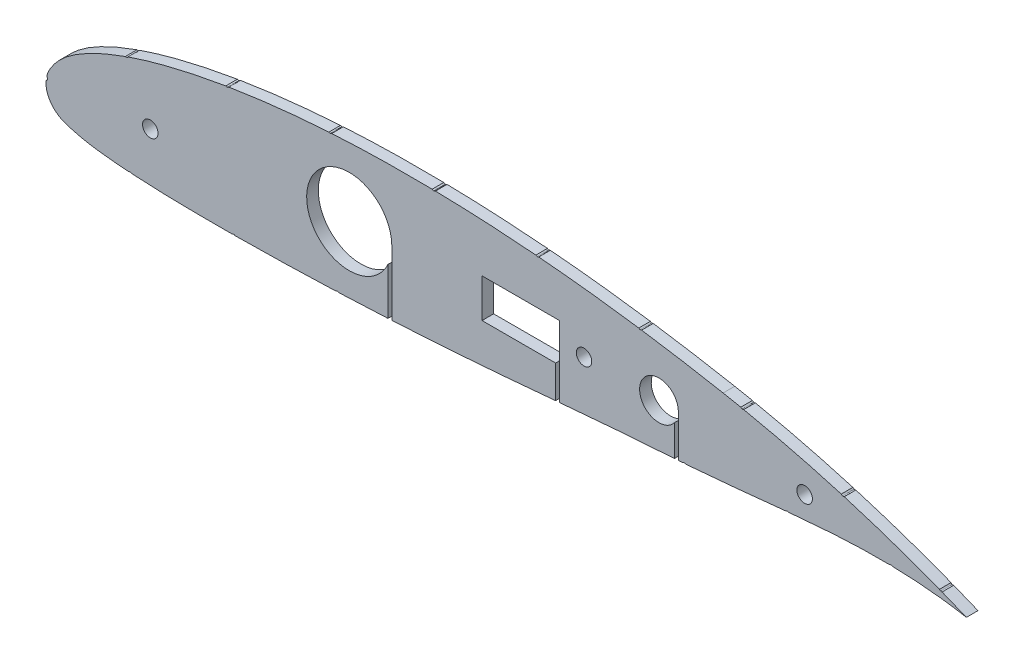
from build123d import *

# Parameters (mm, degrees)
SKETCH5_R           = 2
BOSS_EXTRUDE1_DEPTH = 3
CUT_EXTRUDE1_DEPTH  = 10


with BuildPart() as part:
    # Sketch5 → Boss-Extrude1 (new body)
    with BuildSketch(Plane.XY):
        with BuildLine():
            ThreePointArc((-60.40676614, 16.162496642), (-81.15385877, 23.090280217), (-59.40676614, 20.745072337))
            Line((-59.40676614, 20.745072337), (-59.40676614, 4.127531865))
            add(Edge.make_bspline(
                [(-59.40676614, 4.127531865), (-56.018262466, 4.308098308), (-47.937394752, 4.779305212), (-35.160445535, 5.701220122), (-24.536889777, 6.648809407), (-18.536419357, 7.188062), (-17.192502191, 7.308335338), (-17.109161558, 7.315791129)],
                knots=[1.696187526, 1.696187526, 1.696187526, 1.696187526, 1.71875, 1.75, 1.78125, 1.789719737, 1.790279718, 1.790279718, 1.790279718, 1.790279718], degree=3))
            Line((-17.109161558, 7.315791129), (-17.109161558, 15.745072337))
            Line((-17.109161558, 15.745072337), (-36.109161558, 15.745072337))
            Line((-36.109161558, 15.745072337), (-36.109161558, 25.745072337))
            Line((-36.109161558, 25.745072337), (-16.109161558, 25.745072337))
            Line((-16.109161558, 25.745072337), (-16.109161558, 7.405095685))
            add(Edge.make_bspline(
                [(-16.109161558, 7.405095685), (-16.025835477, 7.412523422), (-13.052799236, 7.677419778), (-5.437797345, 8.345259497), (3.85457575, 9.082728966), (10.779350171, 9.549869356), (13.069020219, 9.692680395), (13.59323386, 9.72473994)],
                knots=[0.792519643, 0.792519643, 0.792519643, 0.792519643, 0.793079624, 0.8125, 0.84375, 0.855658983, 0.859195484, 0.859195484, 0.859195484, 0.859195484], degree=3))
            Line((13.59323386, 9.72473994), (13.59323386, 17.745072337))
            ThreePointArc((13.59323386, 17.745072337), (4.84981737, 22.326211167), (14.59323386, 20.745072337))
            Line((14.59323386, 20.745072337), (14.59323386, 9.787860429))
            add(Edge.make_bspline(
                [(14.59323386, 9.787860429), (39.457967562, 11.405371782), (63.914204067, 16.521781828), (89.001589365, 11.90459949)],
                knots=[0.013225622, 0.013225622, 0.013225622, 0.013225622, 1, 1, 1, 1], degree=3))
            add(Edge.make_bspline(
                [(26.170479229, 30.680952694), (58.67186968, 24.512007909), (89.001589365, 11.90459949)],
                knots=[0.042583337, 0.042583337, 0.042583337, 1, 1, 1], degree=2))
            add(Edge.make_bspline(
                [(26.170479229, 30.680952694), (25.205886107, 30.862092815), (24.240734662, 31.040790729), (23.275033018, 31.216972304)],
                knots=[1.117594243, 1.117594243, 1.117594243, 1.117594243, 1.124095827, 1.124095827, 1.124095827, 1.124095827], degree=3))
            add(Edge.make_bspline(
                [(23.275033018, 31.216972304), (23.140733298, 31.241473801), (20.685406709, 31.688495788), (15.90216026, 32.526318551), (6.579010651, 34.033015696), (-5.133055867, 35.666116217), (-19.248648242, 37.161252915), (-33.403308977, 38.20593019), (-47.608866156, 38.758894607), (-61.832005855, 38.778890697), (-73.705471575, 38.305381276), (-83.196414477, 37.581775934), (-90.308420977, 36.856137814), (-97.405481968, 35.933533463), (-104.49016779, 34.799284224), (-111.557384973, 33.413801047), (-117.418017458, 32.027174852), (-122.09641574, 30.737665101), (-125.595780154, 29.665409457), (-129.078314362, 28.475065768), (-132.551428441, 27.135989205), (-135.438628175, 25.862245696), (-137.734204273, 24.71275654), (-139.456975035, 23.768735976), (-141.183426847, 22.709562699), (-142.615229884, 21.713760032), (-143.77801007, 20.791584153), (-144.64229668, 20.031352217), (-145.488501269, 19.19176817), (-146.295459406, 18.276470341), (-146.924853395, 17.446015374), (-147.402133683, 16.747920086), (-147.861509392, 15.987282184), (-148.257481402, 15.133627504), (-148.525334699, 14.278259778), (-148.652359182, 13.678916684), (-148.715065867, 13.146222117), (-148.743623834, 12.770251932), (-148.736306405, 12.117079484), (-148.641099684, 11.351840339), (-148.411222249, 10.482363072), (-147.899630282, 9.332709382), (-147.131184272, 8.253388514), (-146.09059598, 7.280250853), (-145.034194907, 6.604319102), (-144.09938882, 6.176356092), (-143.327943825, 5.907252288), (-142.744414151, 5.736973351), (-142.324681369, 5.618090192), (-141.71235566, 5.446636379), (-140.948050307, 5.240930245), (-139.679457393, 4.923190904), (-138.006428537, 4.575929196), (-136.079399861, 4.278568877), (-134.232487666, 4.048200208), (-132.422823202, 3.849021219), (-130.005739206, 3.616900261), (-126.996429968, 3.386691085), (-123.404146632, 3.187128712), (-119.83886834, 3.041019315), (-116.279828867, 2.935449875), (-111.547802169, 2.840398079), (-105.642152982, 2.793208736), (-98.571156918, 2.826637665), (-91.511359598, 2.931514837), (-84.458643007, 3.096931382), (-75.057376873, 3.391022167), (-67.043131258, 3.735636358), (-61.378179064, 4.023923464), (-60.40676614, 4.074735486)],
                knots=[1.124095827, 1.124095827, 1.124095827, 1.124095827, 1.125, 1.140625, 1.15625, 1.1875, 1.21875, 1.25, 1.28125, 1.3125, 1.34375, 1.359375, 1.375, 1.390625, 1.40625, 1.421875, 1.4375, 1.4453125, 1.453125, 1.4609375, 1.46875, 1.4765625, 1.48046875, 1.484375, 1.48828125, 1.4921875, 1.494140625, 1.49609375, 1.498046875, 1.5, 1.501953125, 1.502929688, 1.50390625, 1.504882812, 1.505371094, 1.505859375, 1.506103516, 1.506347656, 1.506591797, 1.506835938, 1.507324219, 1.5078125, 1.508789062, 1.509765625, 1.510742188, 1.51171875, 1.512695312, 1.513671875, 1.514648438, 1.515625, 1.517578125, 1.51953125, 1.5234375, 1.52734375, 1.53125, 1.53515625, 1.5390625, 1.546875, 1.5546875, 1.5625, 1.5703125, 1.578125, 1.59375, 1.609375, 1.625, 1.640625, 1.65625, 1.6875, 1.693968039, 1.693968039, 1.693968039, 1.693968039], degree=3))
            Line((-60.40676614, 4.074735486), (-60.40676614, 16.162496642))
        make_face()
        with Locations((-121.802810719, 15.770135151)):
            Circle(SKETCH5_R, mode=Mode.SUBTRACT)
        with Locations((-9.768805549, 20.745072337)):
            Circle(SKETCH5_R, mode=Mode.SUBTRACT)
        with Locations((47.224088979, 18.510484191)):
            Circle(SKETCH5_R, mode=Mode.SUBTRACT)
    extrude(amount=BOSS_EXTRUDE1_DEPTH)

    # Sketch7 → Cut-Extrude1 (cut)
    with BuildSketch(Plane.XY.offset(3)):
        with BuildLine():
            add(Edge.make_bspline(
                [(16.21825242, 8.784876345), (16.259184081, 8.789413375), (16.339963726, 8.798367314), (16.454267786, 8.840945016), (16.556617491, 8.906435992), (16.645777902, 8.990712231), (16.719394455, 9.090035318), (16.768001149, 9.202436776), (16.797093983, 9.322662302), (16.795576643, 9.405322656), (16.794800595, 9.447599492)],
                knots=[0, 0, 0, 0, 1.008551734, 1.990401769, 2.963795233, 3.975124345, 4.989077639, 5.976923761, 6.96529281, 8, 8, 8, 8], degree=3))
            add(Edge.make_bspline(
                [(16.794800595, 9.447599492), (16.790292938, 9.48905676), (16.781501642, 9.569910976), (16.738018566, 9.68427924), (16.673591891, 9.787287792), (16.588250961, 9.876542939), (16.490007963, 9.951370691), (16.378342504, 10.000474661), (16.260064127, 10.029654717), (16.178841621, 10.028501346), (16.137541484, 10.027914878)],
                knots=[0, 0, 0, 0, 1.023997766, 1.997105467, 2.984762853, 3.999358255, 5.025095789, 6.005808386, 6.985990561, 8, 8, 8, 8], degree=3))
            add(Edge.make_bspline(
                [(16.137541484, 10.027914878), (16.096557415, 10.023522483), (16.015567558, 10.014842537), (15.902353378, 9.970258694), (15.800118058, 9.904852451), (15.712157323, 9.819347965), (15.63908966, 9.719895173), (15.587208286, 9.609685221), (15.560893691, 9.490520872), (15.561658846, 9.409582858), (15.56204876, 9.368337826)],
                knots=[0, 0, 0, 0, 1.014223692, 2.004238078, 2.971984967, 3.996096613, 5.015752243, 6.005389553, 6.983570672, 8, 8, 8, 8], degree=3))
            add(Edge.make_bspline(
                [(15.56204876, 9.368337826), (15.566645691, 9.326389257), (15.575665445, 9.24408091), (15.619181467, 9.12851373), (15.682069899, 9.023200782), (15.768918397, 8.93540095), (15.86744354, 8.862170847), (15.977706188, 8.811882226), (16.095769986, 8.783223605), (16.176965836, 8.784319237), (16.21825242, 8.784876345)],
                knots=[0, 0, 0, 0, 1.033678718, 2.028207129, 3.008584491, 4.027785302, 5.042551465, 6.010634732, 6.988444669, 8, 8, 8, 8], degree=3))
        make_face()
        with BuildLine():
            add(Edge.make_bspline(
                [(42.865136682, 11.292805353), (42.9060173, 11.297926984), (42.985918445, 11.30793721), (43.098564485, 11.352314228), (43.199185139, 11.418582088), (43.288065683, 11.503096691), (43.358800763, 11.603582596), (43.406565574, 11.714946327), (43.432313986, 11.83447944), (43.429766897, 11.916293668), (43.428458671, 11.958314798)],
                knots=[0, 0, 0, 0, 1.01617143, 1.986106501, 2.963426972, 3.981954403, 5.003345863, 5.981049462, 6.963033878, 8, 8, 8, 8], degree=3))
            add(Edge.make_bspline(
                [(43.428458671, 11.958314798), (43.423351587, 11.999217757), (43.413309237, 12.079647577), (43.368259929, 12.192651567), (43.304457301, 12.295870074), (43.21848887, 12.383830759), (43.119816964, 12.457294555), (43.008812052, 12.505968437), (42.89055976, 12.532029729), (42.810160563, 12.529942559), (42.769103963, 12.528876726)],
                knots=[0, 0, 0, 0, 1.01730789, 2.000390532, 2.98568518, 4.005351705, 5.028325863, 6.014077547, 6.985870166, 8, 8, 8, 8], degree=3))
            add(Edge.make_bspline(
                [(42.769103963, 12.528876726), (42.728163835, 12.523885721), (42.647571908, 12.51406077), (42.535286715, 12.467380113), (42.433464228, 12.402071484), (42.347123133, 12.315023451), (42.27596466, 12.214946853), (42.227249894, 12.104044171), (42.19884445, 11.985514531), (42.201505005, 11.904374598), (42.202868147, 11.862802367)],
                knots=[0, 0, 0, 0, 1.016266219, 2.000551976, 2.977963612, 3.99304967, 5.014536406, 5.999278732, 6.974925878, 8, 8, 8, 8], degree=3))
            add(Edge.make_bspline(
                [(42.202868147, 11.862802367), (42.208140257, 11.820933407), (42.218387299, 11.739555558), (42.263332039, 11.625173241), (42.329118944, 11.522586251), (42.415845259, 11.435318068), (42.514551096, 11.36327674), (42.62503822, 11.314956284), (42.743269279, 11.289864927), (42.824095393, 11.291815106), (42.865136682, 11.292805353)],
                knots=[0, 0, 0, 0, 1.039082297, 2.019593563, 3.006784345, 4.030444087, 5.041847504, 6.008011484, 6.98852275, 8, 8, 8, 8], degree=3))
        make_face()
        with BuildLine():
            add(Edge.make_bspline(
                [(69.469555937, 12.652276769), (69.510924915, 12.65375812), (69.591639928, 12.656648384), (69.708936796, 12.687864157), (69.816195799, 12.743462945), (69.911599093, 12.8204284), (69.991682787, 12.913234442), (70.051546585, 13.019005668), (70.089922685, 13.136015103), (70.094913496, 13.21839184), (70.097471466, 13.260612875)],
                knots=[0, 0, 0, 0, 1.018818879, 1.987817459, 2.965689276, 3.978276789, 4.994094722, 5.971128571, 6.960130564, 8, 8, 8, 8], degree=3))
            add(Edge.make_bspline(
                [(70.097471466, 13.260612875), (70.095984693, 13.30197762), (70.093083851, 13.382684372), (70.061944672, 13.500041055), (70.005876328, 13.60740668), (69.92953381, 13.70418546), (69.836854373, 13.784998216), (69.732894846, 13.847401547), (69.617213184, 13.88470982), (69.53644658, 13.891035347), (69.495268976, 13.894260319)],
                knots=[0, 0, 0, 0, 1.021783378, 1.993601493, 2.974318664, 3.999175963, 5.025639736, 6.00045884, 6.980564877, 8, 8, 8, 8], degree=3))
            add(Edge.make_bspline(
                [(69.495268976, 13.894260319), (69.453869286, 13.892912486), (69.372947866, 13.89027796), (69.255713136, 13.857015642), (69.148430238, 13.800072984), (69.053347315, 13.721734651), (68.973365016, 13.628448192), (68.911148852, 13.524233017), (68.875833805, 13.407663349), (68.869238377, 13.327110674), (68.865870256, 13.285974425)],
                knots=[0, 0, 0, 0, 1.020749127, 1.995195341, 2.980928364, 4.003433368, 5.021175863, 6.005770845, 6.981596752, 8, 8, 8, 8], degree=3))
            add(Edge.make_bspline(
                [(68.865870256, 13.285974425), (68.867259938, 13.244099266), (68.86999206, 13.161772504), (68.902473199, 13.043081384), (68.958779543, 12.934712075), (69.034747521, 12.837948059), (69.127943182, 12.758378168), (69.232282919, 12.698001064), (69.347437625, 12.659891607), (69.428332098, 12.654847332), (69.469555937, 12.652276769)],
                knots=[0, 0, 0, 0, 1.030765742, 2.026490355, 3.00418551, 4.025884776, 5.041519191, 6.007572879, 6.984658782, 8, 8, 8, 8], degree=3))
        make_face()
        with BuildLine():
            add(Edge.make_bspline(
                [(82.800417916, 15.60561054), (82.761473174, 15.619251725), (82.685078211, 15.646010607), (82.564365145, 15.65784651), (82.444423347, 15.643412419), (82.327814786, 15.607240271), (82.21840898, 15.551019262), (82.124870734, 15.473535974), (82.048071345, 15.377487547), (82.0140094, 15.302814539), (81.996469745, 15.264362865)],
                knots=[0, 0, 0, 0, 1.016153804, 1.993312293, 2.963114404, 3.981248373, 4.993503921, 5.979856359, 6.959759253, 8, 8, 8, 8], degree=3))
            add(Edge.make_bspline(
                [(81.996469745, 15.264362865), (81.982820527, 15.225417638), (81.956045885, 15.149021723), (81.944256259, 15.027613654), (81.958565481, 14.906955693), (81.99494743, 14.789162696), (82.051837465, 14.680069525), (82.129185636, 14.586728587), (82.222593865, 14.509195722), (82.29618216, 14.475355106), (82.333610974, 14.458142938)],
                knots=[0, 0, 0, 0, 1.017554018, 1.996058988, 2.984451939, 4.00398885, 5.029159616, 6.004755324, 6.985169574, 8, 8, 8, 8], degree=3))
            add(Edge.make_bspline(
                [(82.333610974, 14.458142938), (82.372913066, 14.444836466), (82.44943637, 14.418928044), (82.57064413, 14.408370217), (82.690785046, 14.421889022), (82.807705508, 14.459903964), (82.915874915, 14.51755788), (83.007633252, 14.596348688), (83.085489906, 14.689292667), (83.119280332, 14.7629377), (83.136466973, 14.800395372)],
                knots=[0, 0, 0, 0, 1.024974896, 1.995681667, 2.986073397, 4.001551787, 5.024766565, 6.000720437, 6.983117331, 8, 8, 8, 8], degree=3))
            add(Edge.make_bspline(
                [(83.136466973, 14.800395372), (83.149988656, 14.840068057), (83.176436006, 14.917664715), (83.189492411, 15.039439052), (83.177068048, 15.160303785), (83.138388405, 15.276266463), (83.083117836, 15.385158438), (83.006070834, 15.478515996), (82.91115919, 15.554142514), (82.837743331, 15.58826321), (82.800417916, 15.60561054)],
                knots=[0, 0, 0, 0, 1.033869144, 2.022166859, 3.001340227, 4.01474916, 5.028379498, 6.003955906, 6.98518965, 8, 8, 8, 8], degree=3))
        make_face()
        with BuildLine():
            add(Edge.make_bspline(
                [(57.374158274, 24.263689941), (57.334094554, 24.273169096), (57.256010797, 24.291643867), (57.135193373, 24.291128893), (57.017951603, 24.264071677), (56.906129746, 24.215140385), (56.80359383, 24.148566579), (56.719127365, 24.061664429), (56.6516551, 23.959903971), (56.625440888, 23.882423092), (56.612115494, 23.843037465)],
                knots=[0, 0, 0, 0, 1.018736959, 1.985507357, 2.966199965, 3.983975397, 5.00086246, 5.978093111, 6.972210041, 8, 8, 8, 8], degree=3))
            add(Edge.make_bspline(
                [(56.612115494, 23.843037465), (56.602753856, 23.802977507), (56.584413416, 23.724495811), (56.583401972, 23.603183306), (56.611503047, 23.485517674), (56.658366716, 23.3724644), (56.726197285, 23.270360261), (56.810839239, 23.184203227), (56.912394385, 23.11807747), (56.988431794, 23.091250049), (57.027050398, 23.077624682)],
                knots=[0, 0, 0, 0, 1.019633266, 1.997569422, 2.979124866, 4.004660545, 5.022442288, 6.003074928, 6.985782658, 8, 8, 8, 8], degree=3))
            add(Edge.make_bspline(
                [(57.027050398, 23.077624682), (57.067111843, 23.068148893), (57.145191168, 23.049680684), (57.266040689, 23.05014815), (57.383158602, 23.077388684), (57.495703731, 23.125711497), (57.597037585, 23.195420484), (57.681926221, 23.282082835), (57.748738013, 23.383533065), (57.775500693, 23.459628887), (57.789093178, 23.498277158)],
                knots=[0, 0, 0, 0, 1.019784101, 1.987548227, 2.969248873, 3.988070459, 5.012506245, 6.002779521, 6.985632624, 8, 8, 8, 8], degree=3))
            add(Edge.make_bspline(
                [(57.789093178, 23.498277158), (57.79887401, 23.538749274), (57.818092999, 23.618275552), (57.817662767, 23.740302378), (57.792019794, 23.858533056), (57.743470301, 23.970241013), (57.674620574, 24.070882394), (57.590436241, 24.15716711), (57.488796943, 24.223222689), (57.412771036, 24.250059703), (57.374158274, 24.263689941)],
                knots=[0, 0, 0, 0, 1.030012891, 2.023938959, 2.995802268, 4.013459853, 5.025404174, 6.005061343, 6.986791537, 8, 8, 8, 8], degree=3))
        make_face()
        with BuildLine():
            add(Edge.make_bspline(
                [(31.330282648, 30.786520204), (31.289370886, 30.792855516), (31.20924216, 30.805263694), (31.087625485, 30.796781299), (30.97217391, 30.759746788), (30.863481114, 30.702324334), (30.768116965, 30.624525302), (30.687071188, 30.532933499), (30.630963285, 30.423235102), (30.609483682, 30.344007133), (30.598532663, 30.303614066)],
                knots=[0, 0, 0, 0, 1.017037865, 1.991944219, 2.967990593, 3.98159658, 5.000164099, 5.982268228, 6.971292906, 8, 8, 8, 8], degree=3))
            add(Edge.make_bspline(
                [(30.598532663, 30.303614066), (30.59201928, 30.262681308), (30.579225917, 30.182282583), (30.590383792, 30.060346764), (30.6257349, 29.943522529), (30.683077832, 29.834378181), (30.757621847, 29.73673107), (30.850666306, 29.659533526), (30.956057899, 29.598999929), (31.034858161, 29.578578281), (31.07500057, 29.568175091)],
                knots=[0, 0, 0, 0, 1.019544405, 2.002554324, 2.990327538, 4.014101528, 5.030205597, 5.999477124, 6.98089414, 8, 8, 8, 8], degree=3))
            add(Edge.make_bspline(
                [(31.07500057, 29.568175091), (31.115955691, 29.561521838), (31.195966704, 29.548523867), (31.316819449, 29.561432935), (31.433860072, 29.593772767), (31.541667999, 29.654209252), (31.638731795, 29.731081202), (31.716531886, 29.825174506), (31.775530266, 29.932397072), (31.796209926, 30.011010947), (31.806750556, 30.051081228)],
                knots=[0, 0, 0, 0, 1.018198843, 1.989180332, 2.967860581, 3.992171291, 5.011901535, 6.003255219, 6.982239123, 8, 8, 8, 8], degree=3))
            add(Edge.make_bspline(
                [(31.806750556, 30.051081228), (31.81347171, 30.092466177), (31.826669914, 30.173733023), (31.815992031, 30.296230353), (31.782604598, 30.413457223), (31.724093285, 30.521900153), (31.646855052, 30.61701195), (31.556066539, 30.697370648), (31.448812974, 30.75512175), (31.370300994, 30.775919422), (31.330282648, 30.786520204)],
                knots=[0, 0, 0, 0, 1.029383351, 2.021380768, 2.999587737, 4.013860053, 5.033097165, 6.004220827, 6.982731304, 8, 8, 8, 8], degree=3))
        make_face()
        with BuildLine():
            add(Edge.make_bspline(
                [(4.91469933, 35.368423935), (4.873660639, 35.372322694), (4.793306147, 35.379956535), (4.672677631, 35.365799253), (4.559809761, 35.32233349), (4.455374216, 35.259181055), (4.361153185, 35.180617261), (4.288956394, 35.082738644), (4.233848943, 34.972814041), (4.217758362, 34.891864605), (4.209517212, 34.850404545)],
                knots=[0, 0, 0, 0, 1.015967795, 1.989283144, 2.96619219, 3.977378587, 4.993566519, 5.971162213, 6.960885469, 8, 8, 8, 8], degree=3))
            add(Edge.make_bspline(
                [(4.209517212, 34.850404545), (4.205679809, 34.809371311), (4.198123817, 34.728575306), (4.211640798, 34.607009736), (4.254868403, 34.492895149), (4.316882436, 34.386171225), (4.397752157, 34.293594279), (4.492581153, 34.218059775), (4.602451224, 34.1668398), (4.681360577, 34.149591767), (4.721577424, 34.140801154)],
                knots=[0, 0, 0, 0, 1.016772016, 2.002062903, 2.989549301, 4.009840585, 5.037134236, 6.008456238, 6.984992193, 8, 8, 8, 8], degree=3))
            add(Edge.make_bspline(
                [(4.721577424, 34.140801154), (4.762510253, 34.136082379), (4.842963328, 34.126807671), (4.963198537, 34.144699102), (5.078005454, 34.184125965), (5.182922286, 34.249512931), (5.275023827, 34.331604929), (5.348300621, 34.429175397), (5.402886323, 34.538376572), (5.418735919, 34.61834016), (5.426759542, 34.658820544)],
                knots=[0, 0, 0, 0, 1.012782845, 1.990614789, 2.969664836, 3.989410989, 5.019333051, 5.996479144, 6.985747222, 8, 8, 8, 8], degree=3))
            add(Edge.make_bspline(
                [(5.426759542, 34.658820544), (5.431031154, 34.700812352), (5.439347402, 34.782564697), (5.425026009, 34.904594485), (5.384359626, 35.018979443), (5.321023257, 35.124116182), (5.239339153, 35.215642865), (5.144032868, 35.290844987), (5.033847714, 35.342417489), (4.954923666, 35.359644193), (4.91469933, 35.368423935)],
                knots=[0, 0, 0, 0, 1.03886972, 2.022538217, 3.001199963, 4.011520449, 5.030643081, 6.011735533, 6.986663515, 8, 8, 8, 8], degree=3))
        make_face()
        with BuildLine():
            add(Edge.make_bspline(
                [(-21.734587608, 38.431126048), (-21.775736696, 38.433323986), (-21.856563916, 38.437641294), (-21.975865143, 38.413764625), (-22.088083932, 38.367236964), (-22.189086499, 38.296513996), (-22.277400011, 38.210895132), (-22.34605287, 38.109505027), (-22.391454806, 37.994833785), (-22.40410271, 37.913100689), (-22.410549388, 37.871441059)],
                knots=[0, 0, 0, 0, 1.009835977, 1.983573343, 2.962160481, 3.977183944, 4.996643178, 5.971064002, 6.96584458, 8, 8, 8, 8], degree=3))
            add(Edge.make_bspline(
                [(-22.410549388, 37.871441059), (-22.41282455, 37.830278785), (-22.417328859, 37.748786736), (-22.391960172, 37.629057396), (-22.345083318, 37.516096546), (-22.275506128, 37.413825586), (-22.189547442, 37.325843085), (-22.089255768, 37.257422411), (-21.977226759, 37.210167386), (-21.896734857, 37.197994868), (-21.855998394, 37.191834431)],
                knots=[0, 0, 0, 0, 1.012392078, 2.004308696, 2.985372838, 4.011767835, 5.033807529, 5.999596502, 6.987607922, 8, 8, 8, 8], degree=3))
            add(Edge.make_bspline(
                [(-21.855998394, 37.191834431), (-21.81482082, 37.189482068), (-21.733761473, 37.184851367), (-21.614699786, 37.21105436), (-21.502361151, 37.257182987), (-21.400635447, 37.327487342), (-21.314709961, 37.415637267), (-21.245718616, 37.51612222), (-21.200504387, 37.629363931), (-21.188056209, 37.709629121), (-21.181747945, 37.750304471)],
                knots=[0, 0, 0, 0, 1.013509308, 1.99512491, 2.97727171, 3.995987373, 5.022063742, 6.000029072, 6.986490692, 8, 8, 8, 8], degree=3))
            add(Edge.make_bspline(
                [(-21.181747945, 37.750304471), (-21.179131025, 37.792475547), (-21.174009715, 37.875004316), (-21.200673066, 37.995430294), (-21.243745063, 38.109831152), (-21.315591839, 38.21056041), (-21.400914132, 38.299034175), (-21.501639794, 38.366916754), (-21.614037254, 38.412614386), (-21.693882329, 38.424875362), (-21.734587608, 38.431126048)],
                knots=[0, 0, 0, 0, 1.034447309, 2.024412709, 3.007471988, 4.023062955, 5.043092175, 6.018057803, 6.989599418, 8, 8, 8, 8], degree=3))
        make_face()
        with BuildLine():
            add(Edge.make_bspline(
                [(-48.558638429, 39.764581556), (-48.600158039, 39.763071493), (-48.681100722, 39.760127617), (-48.796392343, 39.722503734), (-48.903524119, 39.666858929), (-48.996613974, 39.586543), (-49.075931653, 39.492584672), (-49.134618962, 39.385907525), (-49.169682132, 39.268025309), (-49.174156757, 39.185973187), (-49.17645651, 39.143802142)],
                knots=[0, 0, 0, 0, 1.019734838, 1.987978084, 2.960820358, 3.979898408, 4.997296077, 5.97919603, 6.961398992, 8, 8, 8, 8], degree=3))
            add(Edge.make_bspline(
                [(-49.17645651, 39.143802142), (-49.174874931, 39.10230383), (-49.171773748, 39.020933327), (-49.134827497, 38.904920169), (-49.078420421, 38.79719899), (-48.998634923, 38.703539011), (-48.906443855, 38.621537339), (-48.799715346, 38.563889397), (-48.683578694, 38.528465272), (-48.602966342, 38.524019989), (-48.561769484, 38.521748232)],
                knots=[0, 0, 0, 0, 1.021982574, 2.0039185, 2.978905148, 4.009334003, 5.026920303, 6.010984595, 6.98351574, 8, 8, 8, 8], degree=3))
            add(Edge.make_bspline(
                [(-48.561769484, 38.521748232), (-48.520297972, 38.524055041), (-48.439667526, 38.528540024), (-48.32299973, 38.563381682), (-48.215997634, 38.620826913), (-48.122337786, 38.701178868), (-48.042633918, 38.794785669), (-47.986085766, 38.90233387), (-47.950835375, 39.018771204), (-47.946305865, 39.099852956), (-47.944004757, 39.141044565)],
                knots=[0, 0, 0, 0, 1.023243341, 1.989427531, 2.980866222, 4.001917679, 5.0212855, 5.999682368, 6.983787329, 8, 8, 8, 8], degree=3))
            add(Edge.make_bspline(
                [(-47.944004757, 39.141044565), (-47.945566506, 39.183033385), (-47.948628673, 39.265362113), (-47.985537657, 39.382829485), (-48.04121424, 39.491098125), (-48.120315413, 39.585353349), (-48.214371486, 39.664180654), (-48.320568033, 39.722588441), (-48.436861839, 39.757825737), (-48.517452603, 39.762296684), (-48.558638429, 39.764581556)],
                knots=[0, 0, 0, 0, 1.03165695, 2.022800487, 3.006034335, 4.016791668, 5.034002893, 6.015722908, 6.98593725, 8, 8, 8, 8], degree=3))
        make_face()
        with BuildLine():
            add(Edge.make_bspline(
                [(-75.364938734, 39.267388775), (-75.405938977, 39.263575207), (-75.48685397, 39.256049035), (-75.601566631, 39.215867278), (-75.704657977, 39.15174731), (-75.794168423, 39.068003048), (-75.869122251, 38.969862842), (-75.922801167, 38.859928307), (-75.95317579, 38.740010787), (-75.953259465, 38.657389465), (-75.95330226, 38.615132591)],
                knots=[0, 0, 0, 0, 1.009529288, 1.992330995, 2.955598602, 3.974970076, 4.989906159, 5.974962864, 6.964289904, 8, 8, 8, 8], degree=3))
            add(Edge.make_bspline(
                [(-75.95330226, 38.615132591), (-75.949503957, 38.574123505), (-75.942007914, 38.49319106), (-75.901454923, 38.378176645), (-75.837588041, 38.273937231), (-75.753527921, 38.183172396), (-75.656368107, 38.106636876), (-75.546568974, 38.054476954), (-75.429077134, 38.023635361), (-75.347869498, 38.023280889), (-75.306576922, 38.023100646)],
                knots=[0, 0, 0, 0, 1.012401809, 1.997999988, 2.975109312, 4.007301244, 5.033639693, 6.004640115, 6.985396517, 8, 8, 8, 8], degree=3))
            add(Edge.make_bspline(
                [(-75.306576922, 38.023100646), (-75.265488284, 38.02670173), (-75.184291785, 38.033817942), (-75.070525659, 38.077232101), (-74.96518584, 38.138020885), (-74.875536602, 38.222962461), (-74.801351264, 38.321726246), (-74.749069539, 38.431774902), (-74.720283676, 38.550009817), (-74.719648756, 38.63097257), (-74.719325209, 38.672230208)],
                knots=[0, 0, 0, 0, 1.013161495, 2.00213904, 2.975017287, 3.99805638, 5.025455035, 6.007478508, 6.984635179, 8, 8, 8, 8], degree=3))
            add(Edge.make_bspline(
                [(-74.719325209, 38.672230208), (-74.723174912, 38.714247538), (-74.730728513, 38.796690802), (-74.77205726, 38.913121786), (-74.833288707, 39.01891909), (-74.91676369, 39.109571957), (-75.014865176, 39.183992181), (-75.124071316, 39.237909794), (-75.242757542, 39.266344711), (-75.323694328, 39.267036333), (-75.364938734, 39.267388775)],
                knots=[0, 0, 0, 0, 1.032977819, 2.026831877, 3.006544483, 4.017998065, 5.032076153, 6.016300122, 6.989130566, 8, 8, 8, 8], degree=3))
        make_face()
        with BuildLine():
            add(Edge.make_bspline(
                [(-102.085663428, 36.275060963), (-102.125907685, 36.265903639), (-102.204756274, 36.247962145), (-102.312986211, 36.192462233), (-102.408494784, 36.117790251), (-102.48647796, 36.022677826), (-102.549763873, 35.917489149), (-102.587147791, 35.801036503), (-102.602175194, 35.678933408), (-102.592602687, 35.596872542), (-102.58773633, 35.555155413)],
                knots=[0, 0, 0, 0, 1.012936359, 1.984596315, 2.96711569, 3.97829246, 4.997072169, 5.97162965, 6.968841158, 8, 8, 8, 8], degree=3))
            add(Edge.make_bspline(
                [(-102.58773633, 35.555155413), (-102.578485673, 35.514403291), (-102.560466581, 35.435023388), (-102.504043299, 35.32650158), (-102.4312301, 35.2287417), (-102.335783549, 35.149615607), (-102.229975663, 35.087047848), (-102.115587045, 35.047107818), (-101.99500941, 35.030665228), (-101.914511661, 35.041140394), (-101.873431565, 35.046486143)],
                knots=[0, 0, 0, 0, 1.026240599, 1.998984972, 2.990132508, 4.012888902, 5.032805616, 6.006161393, 6.982492283, 8, 8, 8, 8], degree=3))
            add(Edge.make_bspline(
                [(-101.873431565, 35.046486143), (-101.832718232, 35.055786485), (-101.753413884, 35.073902357), (-101.644619383, 35.129484093), (-101.549166671, 35.204742324), (-101.469296444, 35.299343624), (-101.40742364, 35.406343208), (-101.369918023, 35.522390621), (-101.353695783, 35.643422079), (-101.364164119, 35.724375541), (-101.369477118, 35.765461883)],
                knots=[0, 0, 0, 0, 1.024473129, 1.995542167, 2.977464019, 3.998458943, 5.024666754, 5.998631554, 6.984244713, 8, 8, 8, 8], degree=3))
            add(Edge.make_bspline(
                [(-101.369477118, 35.765461883), (-101.378310702, 35.806858856), (-101.395515642, 35.887486658), (-101.452087543, 35.996705022), (-101.525518592, 36.093976753), (-101.620493309, 36.172883951), (-101.726571899, 36.235729669), (-101.841972028, 36.27539238), (-101.963522771, 36.288516752), (-102.044432762, 36.279603194), (-102.085663428, 36.275060963)],
                knots=[0, 0, 0, 0, 1.035073122, 2.015984818, 2.991693102, 4.010385633, 5.026249765, 6.005354716, 6.983555041, 8, 8, 8, 8], degree=3))
        make_face()
        with BuildLine():
            add(Edge.make_bspline(
                [(-128.223671111, 29.921664727), (-128.262023044, 29.906079577), (-128.337194963, 29.875531818), (-128.435678279, 29.804308625), (-128.518572806, 29.716101693), (-128.581634071, 29.610908599), (-128.624560064, 29.49591268), (-128.646097115, 29.375960456), (-128.639854477, 29.25295181), (-128.617029937, 29.174072324), (-128.605372571, 29.133785553)],
                knots=[0, 0, 0, 0, 1.017487726, 1.99433246, 2.968814441, 3.983667701, 4.995953101, 5.98038097, 6.968503331, 8, 8, 8, 8], degree=3))
            add(Edge.make_bspline(
                [(-128.605372571, 29.133785553), (-128.590306515, 29.095065141), (-128.560818617, 29.019279975), (-128.488749793, 28.92055052), (-128.40011392, 28.836785933), (-128.293969627, 28.772700762), (-128.179171025, 28.728542187), (-128.059849825, 28.707501559), (-127.938394045, 28.71240276), (-127.860221325, 28.734693716), (-127.820309813, 28.746074487)],
                knots=[0, 0, 0, 0, 1.020643014, 1.997643977, 2.984342458, 4.010799492, 5.033699361, 6.001059386, 6.979429871, 8, 8, 8, 8], degree=3))
            add(Edge.make_bspline(
                [(-127.820309813, 28.746074487), (-127.781983138, 28.761681205), (-127.70731952, 28.792084419), (-127.608338534, 28.862887471), (-127.526973596, 28.952665139), (-127.46328666, 29.057915122), (-127.419796169, 29.17326795), (-127.400431113, 29.293427345), (-127.404822377, 29.415855129), (-127.427188967, 29.494037315), (-127.438608352, 29.53395366)],
                knots=[0, 0, 0, 0, 1.018893415, 1.984890944, 2.974679822, 3.990935131, 5.004619032, 5.998617877, 6.978183345, 8, 8, 8, 8], degree=3))
            add(Edge.make_bspline(
                [(-127.438608352, 29.53395366), (-127.453986224, 29.573064043), (-127.484097464, 29.649645651), (-127.556748733, 29.749128008), (-127.645280526, 29.833068668), (-127.75097848, 29.896309955), (-127.865953017, 29.93927968), (-127.984825955, 29.96052437), (-128.106255242, 29.955083883), (-128.183760442, 29.933024187), (-128.223671111, 29.921664727)],
                knots=[0, 0, 0, 0, 1.032158009, 2.021057175, 3.007472327, 4.022196435, 5.034353009, 6.018655598, 6.979722925, 8, 8, 8, 8], degree=3))
        make_face()
        with BuildLine():
            add(Edge.make_bspline(
                [(-149.587141528, 13.779337532), (-149.592050108, 13.738323429), (-149.601679857, 13.657861148), (-149.585953039, 13.537812881), (-149.546649874, 13.42406177), (-149.485672112, 13.318246425), (-149.404964761, 13.225521426), (-149.310528431, 13.148561743), (-149.19927496, 13.096532085), (-149.119736862, 13.07829624), (-149.078983903, 13.068952735)],
                knots=[0, 0, 0, 0, 1.017991173, 1.997115287, 2.961696575, 3.977923209, 4.995914383, 5.985975376, 6.968073587, 8, 8, 8, 8], degree=3))
            add(Edge.make_bspline(
                [(-149.078983903, 13.068952735), (-149.037977078, 13.064166259), (-148.957754305, 13.054802347), (-148.836749145, 13.068814573), (-148.721727847, 13.107703418), (-148.615276789, 13.169908332), (-148.521053981, 13.248693262), (-148.445504063, 13.343188171), (-148.389328916, 13.450875166), (-148.372046884, 13.529897089), (-148.363200385, 13.570347618)],
                knots=[0, 0, 0, 0, 1.018817375, 1.993140288, 2.985213554, 4.002264958, 5.027020017, 6.006250616, 6.97941971, 8, 8, 8, 8], degree=3))
            add(Edge.make_bspline(
                [(-148.363200385, 13.570347618), (-148.358287656, 13.611365025), (-148.348649766, 13.691833787), (-148.364527301, 13.812532499), (-148.404167726, 13.927433719), (-148.467055087, 14.033276151), (-148.546841034, 14.12661574), (-148.642251724, 14.20119987), (-148.751144933, 14.255435545), (-148.830459594, 14.273119764), (-148.870839846, 14.282123058)],
                knots=[0, 0, 0, 0, 1.0179591, 1.997052364, 2.978815022, 4.004458045, 5.022417145, 5.997070749, 6.98027947, 8, 8, 8, 8], degree=3))
            add(Edge.make_bspline(
                [(-148.870839846, 14.282123058), (-148.912312985, 14.287206629), (-148.993657742, 14.297177466), (-149.115730641, 14.281850709), (-149.231312323, 14.2429985), (-149.33798928, 14.181302767), (-149.430410806, 14.100925613), (-149.506745685, 14.007380727), (-149.560535764, 13.898500472), (-149.578129535, 13.8197008), (-149.587141528, 13.779337532)],
                knots=[0, 0, 0, 0, 1.027889257, 2.016085716, 3.005563151, 4.019953365, 5.036104929, 6.012773299, 6.982090133, 8, 8, 8, 8], degree=3))
        make_face()
        with BuildLine():
            add(Edge.make_bspline(
                [(-127.137139204, 2.282844734), (-127.096032413, 2.28160618), (-127.014919901, 2.279162246), (-126.896392655, 2.305109257), (-126.785360131, 2.352849342), (-126.685498401, 2.423521486), (-126.598727057, 2.510662954), (-126.533348195, 2.613806024), (-126.487606255, 2.72829236), (-126.477237061, 2.810198685), (-126.471933991, 2.852087664)],
                knots=[0, 0, 0, 0, 1.010384166, 1.993704543, 2.96179053, 3.971365241, 4.990610989, 5.972418565, 6.963043256, 8, 8, 8, 8], degree=3))
            add(Edge.make_bspline(
                [(-126.471933991, 2.852087664), (-126.47069013, 2.893657244), (-126.468268918, 2.974573683), (-126.492579807, 3.094066682), (-126.542063047, 3.204826332), (-126.611960669, 3.306727636), (-126.698951793, 3.394208513), (-126.800127591, 3.461848872), (-126.913225967, 3.5068386), (-126.993621077, 3.517143298), (-127.03450119, 3.522383135)],
                knots=[0, 0, 0, 0, 1.024032112, 1.993309334, 2.979664958, 3.999831271, 5.02800472, 6.005553421, 6.985843772, 8, 8, 8, 8], degree=3))
            add(Edge.make_bspline(
                [(-127.03450119, 3.522383135), (-127.075597023, 3.523592744), (-127.156687909, 3.525979562), (-127.275627703, 3.500395234), (-127.386582657, 3.45075788), (-127.486111568, 3.378784042), (-127.573357352, 3.29168468), (-127.638419613, 3.188856711), (-127.683741012, 3.075894331), (-127.695167344, 2.995631938), (-127.700978968, 2.954809137)],
                knots=[0, 0, 0, 0, 1.013052103, 1.998968954, 2.975979142, 3.996526184, 5.018463268, 6.002863323, 6.984222753, 8, 8, 8, 8], degree=3))
            add(Edge.make_bspline(
                [(-127.700978968, 2.954809137), (-127.702403513, 2.912720544), (-127.705197937, 2.830158517), (-127.679253224, 2.709750954), (-127.631925951, 2.596769931), (-127.560233898, 2.496140138), (-127.472927236, 2.409296452), (-127.371092486, 2.34364054), (-127.258471719, 2.298300163), (-127.178038629, 2.288054534), (-127.137139204, 2.282844734)],
                knots=[0, 0, 0, 0, 1.032444251, 2.02526823, 3.001854744, 4.026598645, 5.04380223, 6.012626459, 6.989440341, 8, 8, 8, 8], degree=3))
        make_face()
        with BuildLine():
            add(Edge.make_bspline(
                [(-100.290853703, 1.723300607), (-100.24962782, 1.725719696), (-100.168766518, 1.730464546), (-100.052264819, 1.765361004), (-99.947765234, 1.825994786), (-99.852380071, 1.902725429), (-99.775871333, 1.999345605), (-99.718020293, 2.106249266), (-99.68406466, 2.224865557), (-99.680906415, 2.307017292), (-99.67927952, 2.349335805)],
                knots=[0, 0, 0, 0, 1.015625114, 1.99206813, 2.963243972, 3.978210136, 4.991417004, 5.979138252, 6.959001128, 8, 8, 8, 8], degree=3))
            add(Edge.make_bspline(
                [(-99.67927952, 2.349335805), (-99.68167507, 2.390575739), (-99.68637375, 2.471464601), (-99.721733265, 2.58818732), (-99.781439178, 2.693769272), (-99.859244479, 2.789181851), (-99.954553879, 2.867119957), (-100.061028419, 2.924684326), (-100.177136997, 2.960958167), (-100.258063986, 2.963927199), (-100.299441835, 2.965445261)],
                knots=[0, 0, 0, 0, 1.018740848, 1.998179395, 2.98310077, 4.001180646, 5.025339977, 6.005389242, 6.980158485, 8, 8, 8, 8], degree=3))
            add(Edge.make_bspline(
                [(-100.299441835, 2.965445261), (-100.340729781, 2.963200381), (-100.42185184, 2.958789666), (-100.537594211, 2.921314517), (-100.643031231, 2.862064847), (-100.735896281, 2.781941667), (-100.81416491, 2.687340855), (-100.872520222, 2.580620485), (-100.905888473, 2.463347902), (-100.909299776, 2.382211235), (-100.911036916, 2.340893958)],
                knots=[0, 0, 0, 0, 1.018868314, 2.001860191, 2.976137293, 3.992579639, 5.016867114, 5.997039004, 6.980030881, 8, 8, 8, 8], degree=3))
            add(Edge.make_bspline(
                [(-100.911036916, 2.340893958), (-100.908655214, 2.298665723), (-100.904010341, 2.216310843), (-100.868788214, 2.098035055), (-100.808908975, 1.991526641), (-100.729966128, 1.897514804), (-100.63513299, 1.819890274), (-100.529504341, 1.762164438), (-100.412875753, 1.72825431), (-100.332185418, 1.724978542), (-100.290853703, 1.723300607)],
                knots=[0, 0, 0, 0, 1.040129654, 2.028494754, 3.010595, 4.033421595, 5.037462975, 6.014705067, 6.983079635, 8, 8, 8, 8], degree=3))
        make_face()
        with BuildLine():
            add(Edge.make_bspline(
                [(-73.504882629, 2.370583036), (-73.463768803, 2.374005635), (-73.382814222, 2.380744854), (-73.268080122, 2.421384569), (-73.162966705, 2.482298515), (-73.07300975, 2.566020244), (-72.996198733, 2.66250194), (-72.945295805, 2.773656656), (-72.91376696, 2.89258133), (-72.912995581, 2.974983301), (-72.912601884, 3.017039646)],
                knots=[0, 0, 0, 0, 1.011455231, 1.991591199, 2.966042095, 3.981298704, 4.998232158, 5.979576679, 6.968815689, 8, 8, 8, 8], degree=3))
            add(Edge.make_bspline(
                [(-72.912601884, 3.017039646), (-72.91665681, 3.058089448), (-72.924638546, 3.138892063), (-72.964695603, 3.253828536), (-73.02600274, 3.358236047), (-73.107787796, 3.449689767), (-73.205206069, 3.524634027), (-73.313029204, 3.580088117), (-73.430901464, 3.611441445), (-73.511830278, 3.612302438), (-73.553373103, 3.612744408)],
                knots=[0, 0, 0, 0, 1.017194232, 2.002249741, 2.981591644, 3.994510383, 5.016548075, 6.004713056, 6.975768307, 8, 8, 8, 8], degree=3))
            add(Edge.make_bspline(
                [(-73.553373103, 3.612744408), (-73.594396139, 3.608640752), (-73.675146067, 3.600563097), (-73.790254019, 3.561279496), (-73.893301223, 3.497340839), (-73.983853991, 3.414744152), (-74.059419162, 3.317721877), (-74.11366539, 3.209014076), (-74.142414552, 3.090552431), (-74.143655873, 3.009387777), (-74.144290633, 2.967883542)],
                knots=[0, 0, 0, 0, 1.016776422, 2.001427323, 2.97485263, 3.994785953, 5.016403845, 5.997860535, 6.976189007, 8, 8, 8, 8], degree=3))
            add(Edge.make_bspline(
                [(-74.144290633, 2.967883542), (-74.140804761, 2.925794035), (-74.133980562, 2.843396522), (-74.093560556, 2.726949571), (-74.031708985, 2.621490898), (-73.94955447, 2.530381262), (-73.852606581, 2.455242352), (-73.74493053, 2.401660356), (-73.627124897, 2.372258953), (-73.546401796, 2.371152255), (-73.504882629, 2.370583036)],
                knots=[0, 0, 0, 0, 1.037695245, 2.031468473, 3.007728907, 4.034547374, 5.036146002, 6.014916596, 6.97899102, 8, 8, 8, 8], degree=3))
        make_face()
    extrude(amount=-CUT_EXTRUDE1_DEPTH, mode=Mode.SUBTRACT)


solid = part.part
